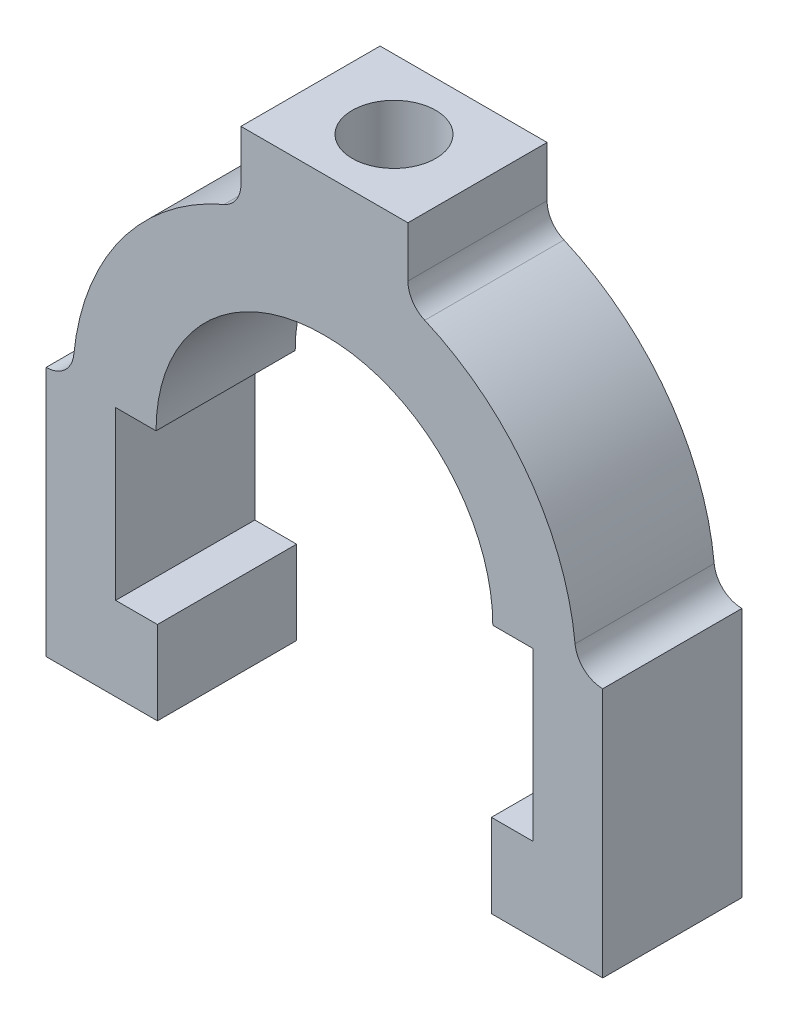
from build123d import *

# Parameters (mm, degrees)
BOSS_EXTRUDE1_DEPTH = 20
SKETCH3_R           = 6
CUT_EXTRUDE1_DEPTH  = 115.891252931


with BuildPart() as part:
    # Sketch2 → Boss-Extrude1 (new body)
    with BuildSketch(Plane.XY):
        with BuildLine():
            Line((28, 72.747460854), (28, 80))
            Line((28, 80), (52, 80))
            Line((52, 80), (52, 72.747460854))
            ThreePointArc((52, 72.747460854), (52.659356425, 70.547438013), (54.420050252, 69.072714769))
            ThreePointArc((54.420050252, 69.072714769), (69.23734115, 57.280554554), (76.020050252, 39.6))
            ThreePointArc((76.020050252, 39.6), (77.316718427, 37.033520605), (80, 36))
            Line((80, 36), (80, 0))
            Line((80, 0), (64, 0))
            Line((64, 0), (64, 12))
            Line((64, 12), (70, 12))
            Line((70, 12), (70, 36))
            Line((70, 36), (64.200502516, 36))
            ThreePointArc((64.200502516, 36), (57.100028243, 53.041303653), (40, 59.999162459))
            ThreePointArc((40, 59.999162459), (22.899971757, 53.041303653), (15.799497484, 36))
            Line((15.799497484, 36), (10, 36))
            Line((10, 36), (10, 12))
            Line((10, 12), (16, 12))
            Line((16, 12), (16, 0))
            Line((16, 0), (0, 0))
            Line((0, 0), (0, 36))
            ThreePointArc((0, 36), (2.683281573, 37.033520605), (3.979949748, 39.6))
            ThreePointArc((3.979949748, 39.6), (10.76265885, 57.280554554), (25.579949748, 69.072714769))
            ThreePointArc((25.579949748, 69.072714769), (27.340643575, 70.547438013), (28, 72.747460854))
        make_face()
    extrude(amount=-BOSS_EXTRUDE1_DEPTH)

    # Sketch3 → Cut-Extrude1 (cut, through all)
    with BuildSketch(Plane(origin=(0, 80, 0), x_dir=(1, 0, 0), z_dir=(0, 1, 0))):
        with Locations(Location((40, 10, 0), (0, 0, 270))):
            Circle(SKETCH3_R)
    extrude(amount=-CUT_EXTRUDE1_DEPTH, mode=Mode.SUBTRACT)


solid = part.part
